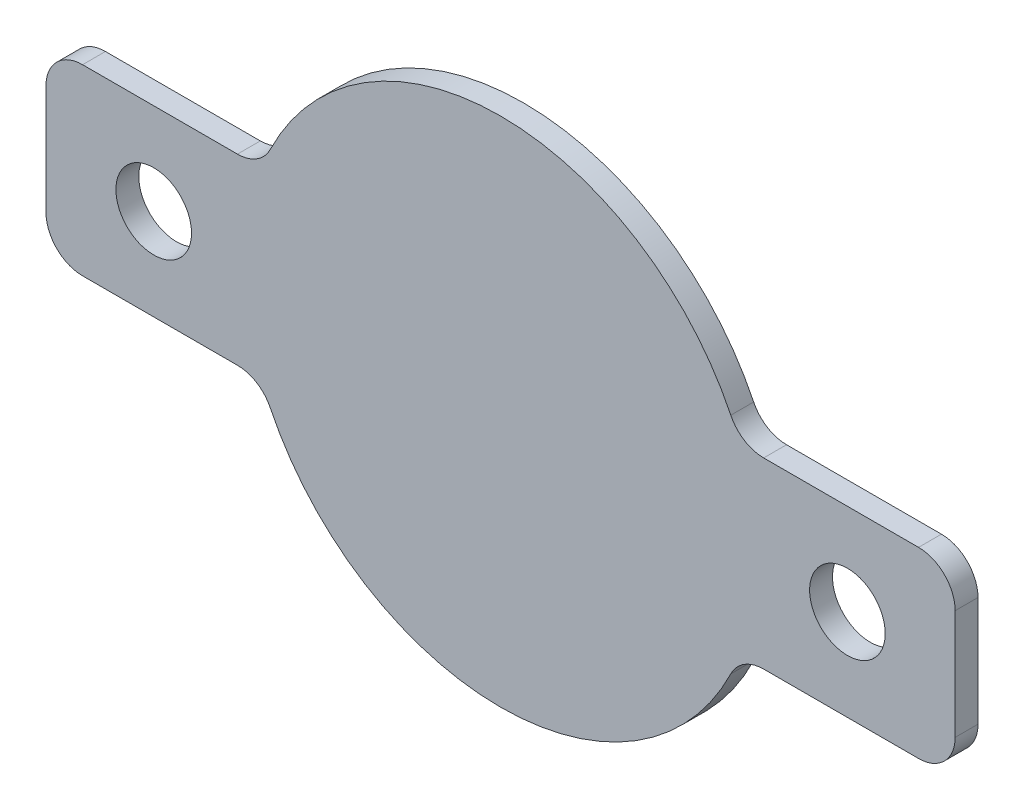
from build123d import *

# Parameters (mm, degrees)
SKETCH1_R           = 2.625
BOSS_EXTRUDE1_DEPTH = 1.5875
FILLET1_R           = 2.54


with BuildPart() as part:
    # Sketch1 → Boss-Extrude1 (new body)
    with BuildSketch(Plane(origin=(0, 0, 0), x_dir=(-1, 0, 0), z_dir=(0, 0, 1))):
        with BuildLine():
            Line((-16.092859192, 4.160440607), (-31.053947254, 4.160440607))
            Line((-31.053947254, 4.160440607), (-31.053947254, -8.539559393))
            Line((-31.053947254, -8.539559393), (-16.092859192, -8.539559393))
            ThreePointArc((-16.092859192, -8.539559393), (0.514545783, -19.969559393), (17.121950758, -8.539559393))
            Line((17.121950758, -8.539559393), (32.08303882, -8.539559393))
            Line((32.08303882, -8.539559393), (32.08303882, 4.160440607))
            Line((32.08303882, 4.160440607), (17.121950758, 4.160440607))
            ThreePointArc((17.121950758, 4.160440607), (0.514545783, 15.590440607), (-16.092859192, 4.160440607))
        make_face()
        with Locations(Location((-23.573403223, -2.189559393, 0), (0, 0, 180))):
            Circle(SKETCH1_R, mode=Mode.SUBTRACT)
        with Locations(Location((24.602494789, -2.189559393, 0), (0, 0, 180))):
            Circle(SKETCH1_R, mode=Mode.SUBTRACT)
    extrude(amount=BOSS_EXTRUDE1_DEPTH)

    # Fillet1
    fillet1_edges = [part.edges().sort_by_distance(p)[0] for p in [
        (-17.121950758, -4.160440607, 0.79375),
        (-32.08303882, -4.160440607, 0.79375),
        (-32.08303882, 8.539559393, 0.79375),
        (-17.121950758, 8.539559393, 0.79375),
        (16.092859192, 8.539559393, 0.79375),
        (31.053947254, 8.539559393, 0.79375),
        (31.053947254, -4.160440607, 0.79375),
        (16.092859192, -4.160440607, 0.79375),
    ]]
    fillet(fillet1_edges, radius=FILLET1_R)


solid = part.part
